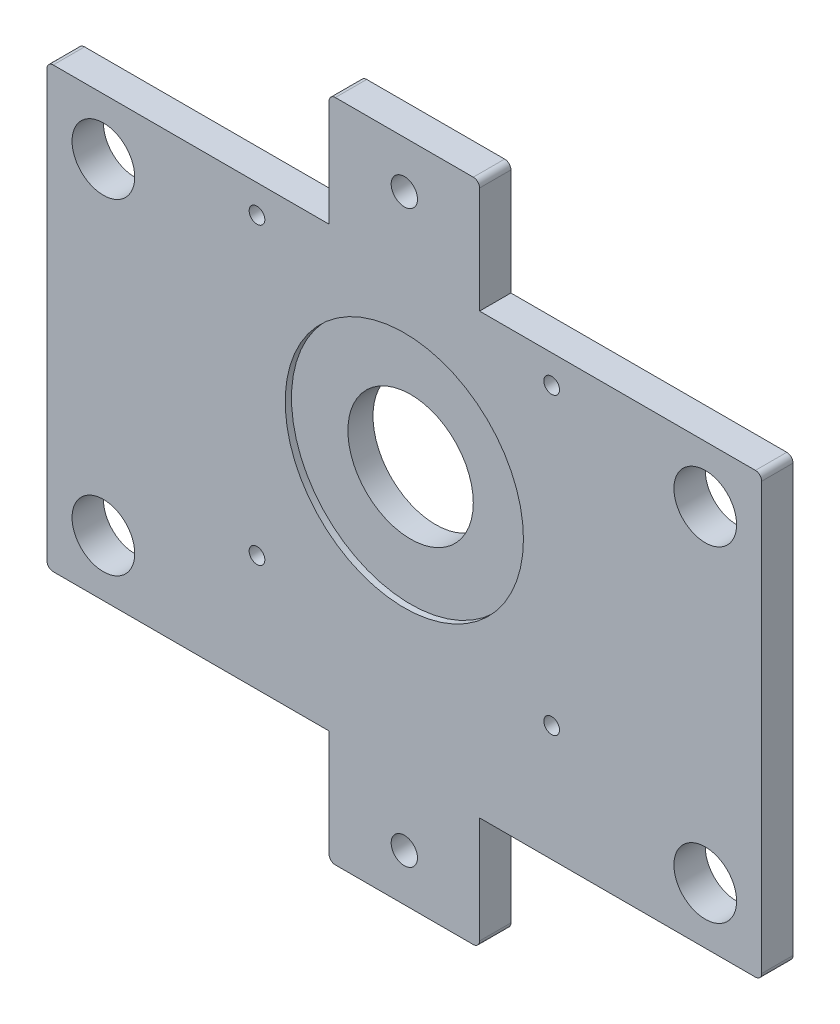
from build123d import *

# Parameters (mm, degrees)
EXTRUDE_1_DEPTH     = 5
FILLET_2_R          = 1
HOLE_WIZARD_M3_1_D  = 2.5
SKETCH_5_R          = 5
CUT_EXTRUDE_1_DEPTH = 5
HOLE_WIZARD_M5_1_D  = 4.2
SKETCH_7_R          = 10
CUT_EXTRUDE_2_DEPTH = 78.99358948
SKETCH_8_R          = 19
CUT_EXTRUDE_3_DEPTH = 1


with BuildPart() as part:
    # 草图1 → 凸台-拉伸1 (new body)
    with BuildSketch(Plane.XY):
        Polygon((-57, 35), (-57, -35), (-12, -35), (-12, -53), (12, -53), (12, -35), (57, -35), (57, 35), (12, 35), (12, 53), (-12, 53), (-12, 35), align=None)
    extrude(amount=EXTRUDE_1_DEPTH)

    # 圆角2
    fillet_2_edges = [part.edges().sort_by_distance(p)[0] for p in [
        (-12, 53, 2.5),
        (12, 53, 2.5),
        (57, 35, 2.5),
        (57, -35, 2.5),
        (12, -53, 2.5),
        (-12, -53, 2.5),
        (-57, -35, 2.5),
        (-57, 35, 2.5),
    ]]
    fillet(fillet_2_edges, radius=FILLET_2_R)

    # M3 螺纹孔的螺纹孔钻头1 (through all)
    with Locations(Plane(origin=(-23.5, 30.5, 5), x_dir=(1, 0, 0), z_dir=(0, 0, 1))):
        with Locations((0, 0), (0, -47)):
            hole_wizard_m3_1 = Hole(HOLE_WIZARD_M3_1_D / 2)

    # 镜向1: M3 螺纹孔的螺纹孔钻头1 across plane
    add(hole_wizard_m3_1.mirror(Plane(origin=(0, 0, 0), x_dir=(0, 0, 1), z_dir=(1, 0, 0))), mode=Mode.SUBTRACT)

    # 草图5 → 切除-拉伸1 (cut)
    with BuildSketch(Plane.XY.offset(5)):
        with Locations((-48, 26)):
            Circle(SKETCH_5_R)
        with Locations((-48, -26)):
            Circle(SKETCH_5_R)
    cut_extrude_1 = extrude(amount=-CUT_EXTRUDE_1_DEPTH, mode=Mode.SUBTRACT)

    # 镜向2: 切除-拉伸1 across plane
    add(cut_extrude_1.mirror(Plane(origin=(0, 0, 0), x_dir=(0, 0, 1), z_dir=(1, 0, 0))), mode=Mode.SUBTRACT)

    # M5 螺纹孔的螺纹孔钻头1 (through all)
    with Locations(Plane(origin=(0, 45.5, 5), x_dir=(1, 0, 0), z_dir=(0, 0, 1))):
        with Locations((0, 0)):
            hole_wizard_m5_1 = Hole(HOLE_WIZARD_M5_1_D / 2)

    # 镜向3: M5 螺纹孔的螺纹孔钻头1 across plane
    add(hole_wizard_m5_1.mirror(Plane.ZX), mode=Mode.SUBTRACT)

    # 草图7 → 切除-拉伸2 (cut, through all)
    with BuildSketch(Plane.XY.offset(5)):
        with Locations((0, 7)):
            Circle(SKETCH_7_R)
    extrude(amount=-CUT_EXTRUDE_2_DEPTH, mode=Mode.SUBTRACT)

    # 草图8 → 切除-拉伸3 (cut)
    with BuildSketch(Plane.XY.offset(5)):
        with Locations((0, 7)):
            Circle(SKETCH_8_R)
    extrude(amount=-CUT_EXTRUDE_3_DEPTH, mode=Mode.SUBTRACT)


solid = part.part
